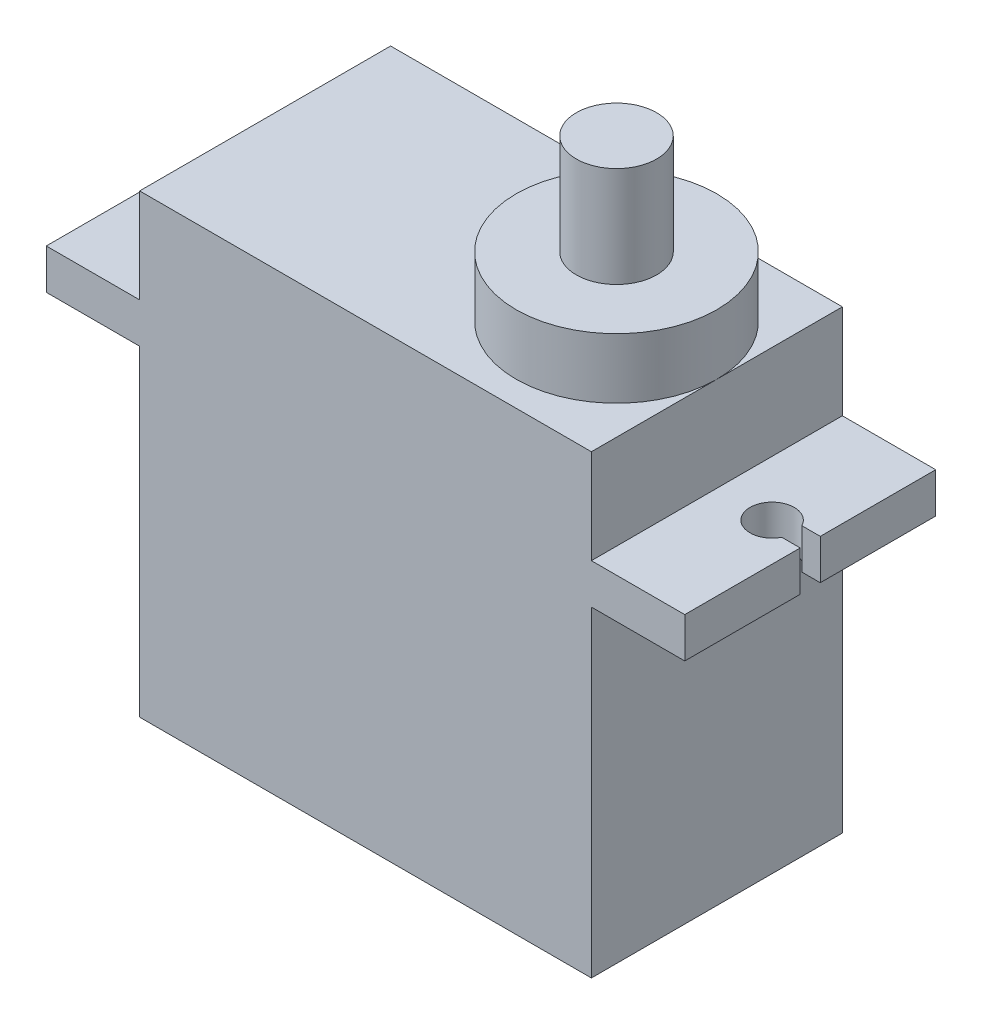
from build123d import *

# Parameters (mm, degrees)
SKETCH_1_W      = 22.5
SKETCH_1_H      = 12.5
EXTRUDE_1_DEPTH = 16
EXTRUDE_2_DEPTH = 2
SKETCH_3_W      = 22.5
SKETCH_3_H      = 12.5
EXTRUDE_3_DEPTH = 4.7
SKETCH_4_R      = 5
EXTRUDE_4_DEPTH = 3
SKETCH_5_R      = 2
EXTRUDE_5_DEPTH = 5


with BuildPart() as part:
    # 草图1 → 凸台-拉伸1 (new body)
    with BuildSketch(Plane(origin=(0, 0, 0), x_dir=(1, 0, 0), z_dir=(0, 1, 0))):
        Rectangle(SKETCH_1_W, SKETCH_1_H)
    extrude(amount=EXTRUDE_1_DEPTH)

    # 草图2 → 凸台-拉伸2 (add)
    with BuildSketch(Plane(origin=(0, 16, 0), x_dir=(1, 0, 0), z_dir=(0, 1, 0))):
        with BuildLine():
            Line((-15.9, 6.25), (15.9, 6.25))
            Line((15.9, 6.25), (15.9, 0.5))
            Line((15.9, 0.5), (14.979795897, 0.5))
            ThreePointArc((14.979795897, 0.5), (12.9, 0), (14.979795897, -0.5))
            Line((14.979795897, -0.5), (15.9, -0.5))
            Line((15.9, -0.5), (15.9, -6.25))
            Line((15.9, -6.25), (-15.9, -6.25))
            Line((-15.9, -6.25), (-15.9, -0.5))
            Line((-15.9, -0.5), (-14.979795897, -0.5))
            ThreePointArc((-14.979795897, -0.5), (-12.9, 0), (-14.979795897, 0.5))
            Line((-14.979795897, 0.5), (-15.9, 0.5))
            Line((-15.9, 0.5), (-15.9, 6.25))
        make_face()
    extrude(amount=EXTRUDE_2_DEPTH)

    # 草图3 → 凸台-拉伸3 (add)
    with BuildSketch(Plane(origin=(0, 18, 0), x_dir=(1, 0, 0), z_dir=(0, 1, 0))):
        Rectangle(SKETCH_3_W, SKETCH_3_H)
    extrude(amount=EXTRUDE_3_DEPTH)

    # 草图4 → 凸台-拉伸4 (add)
    with BuildSketch(Plane(origin=(0, 22.7, 0), x_dir=(1, 0, 0), z_dir=(0, 1, 0))):
        with Locations((6.25, 0)):
            Circle(SKETCH_4_R)
    extrude(amount=EXTRUDE_4_DEPTH)

    # 草图5 → 凸台-拉伸5 (add)
    with BuildSketch(Plane(origin=(0, 25.7, 0), x_dir=(1, 0, 0), z_dir=(0, 1, 0))):
        with Locations(Location((6.25, 0, 0), (0, 0, 270))):
            Circle(SKETCH_5_R)
    extrude(amount=EXTRUDE_5_DEPTH)


solid = part.part
